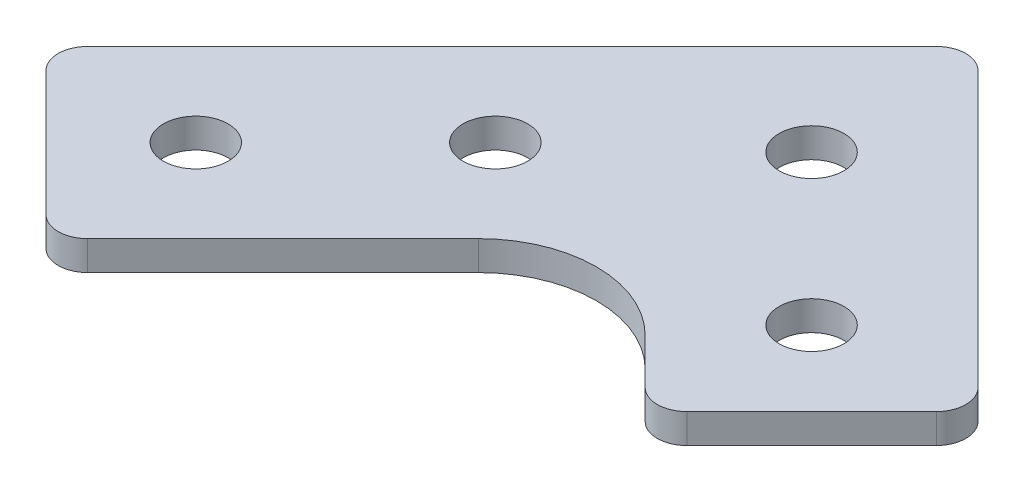
from build123d import *

# Parameters (mm, degrees)
BOSS_EXTRUDE1_DEPTH = 3.175
SKETCH2_R           = 3.4925
CUT_EXTRUDE2_DEPTH  = 3.175
LPATTERN5_COUNT     = 2
LPATTERN5_PITCH     = 22.86
SKETCH7_R           = 3.4925
CUT_EXTRUDE3_DEPTH  = 3.175
LPATTERN6_COUNT     = 3
LPATTERN6_PITCH     = 22.86
SKETCH8_R           = 3.4925
CUT_EXTRUDE4_DEPTH  = 62.882370874
FILLET1_R           = 12.7
FILLET2_R           = 3.175


with BuildPart() as part:
    # Sketch1 → Boss-Extrude1 (new body)
    with BuildSketch(Plane(origin=(0, 0, 0), x_dir=(1, 0, 0), z_dir=(0, 1, 0))):
        Polygon((-17.960512242, 17.960512242), (0, 35.921024484), (17.960512242, 17.960512242), (50.289434278, -14.368409794), (32.328922036, -32.328922036), (0, 0), (-32.328922036, -32.328922036), (-50.289434278, -14.368409794), align=None)
    extrude(amount=BOSS_EXTRUDE1_DEPTH)

    # Sketch2 → Cut-Extrude2 (cut)
    with BuildSketch(Plane(origin=(0, 3.175, 0), x_dir=(1, 0, 0), z_dir=(0, 1, 0))):
        with Locations(Location((-33.226947648, -15.266435406, 0), (0, 0, 270))):
            Circle(SKETCH2_R)
    cut_extrude2 = extrude(amount=-CUT_EXTRUDE2_DEPTH, mode=Mode.SUBTRACT)

    # LPattern5: Cut-Extrude2 ×2
    with Locations(*[Vector(0.7071067811865465, 0, -0.7071067811865487) * (i * LPATTERN5_PITCH) for i in range(1, LPATTERN5_COUNT)]):
        add(cut_extrude2, mode=Mode.SUBTRACT)

    # Sketch7 → Cut-Extrude3 (cut)
    with BuildSketch(Plane(origin=(0, 3.175, 0), x_dir=(1, 0, 0), z_dir=(0, 1, 0))):
        with Locations(Location((33.226947648, -15.266435406, 0), (0, 0, 270))):
            Circle(SKETCH7_R)
    cut_extrude3 = extrude(amount=-CUT_EXTRUDE3_DEPTH, mode=Mode.SUBTRACT)

    # LPattern6: Cut-Extrude3 ×3
    with Locations(*[Vector(-0.7071067811865456, 0, -0.7071067811865496) * (i * LPATTERN6_PITCH) for i in range(1, LPATTERN6_COUNT)]):
        add(cut_extrude3, mode=Mode.SUBTRACT)

    # Sketch8 → Cut-Extrude4 (cut, through all)
    with BuildSketch(Plane(origin=(0, 3.175, 0), x_dir=(1, 0, 0), z_dir=(0, 1, 0))):
        Polygon((16.164461018, -16.164461018), (32.328922036, -32.328922036), (50.289434278, -14.368409794), (34.12497326, 1.796051224), align=None)
        with Locations((33.226947648, -15.266435406)):
            Circle(SKETCH8_R, mode=Mode.SUBTRACT)
    extrude(amount=-CUT_EXTRUDE4_DEPTH, mode=Mode.SUBTRACT)

    # Fillet1
    fillet1_edges = [part.edges().sort_by_distance(p)[0] for p in [
        (0, 1.5875, 0),
    ]]
    fillet(fillet1_edges, radius=FILLET1_R)

    # Fillet2
    fillet2_edges = [part.edges().sort_by_distance(p)[0] for p in [
        (0, 1.5875, -35.921024484),
        (-32.328922036, 1.5875, 32.328922036),
        (-50.289434278, 1.5875, 14.368409794),
        (16.164461018, 1.5875, 16.164461018),
        (34.12497326, 1.5875, -1.796051224),
    ]]
    fillet(fillet2_edges, radius=FILLET2_R)


solid = part.part
